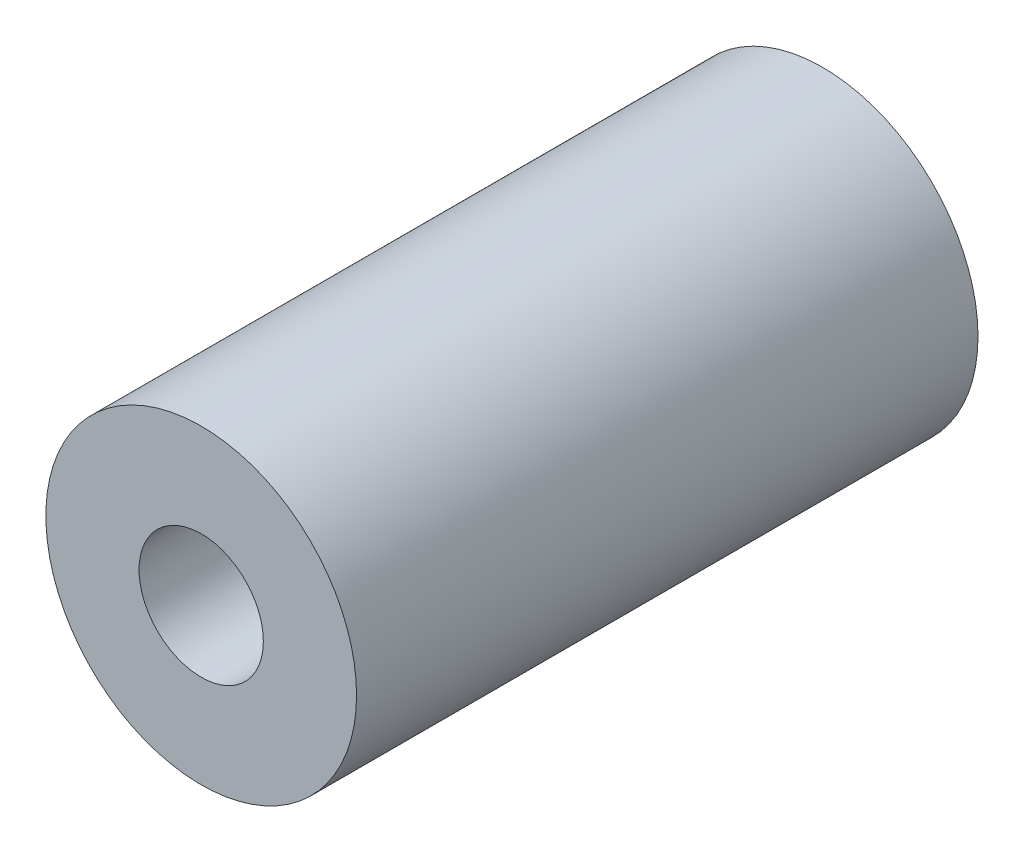
from build123d import *

# Parameters (mm, degrees)
BOSS_EXTRUDE1_DEPTH      = 19.05
BOSS_EXTRUDE1_DEPTH_BACK = 19.05
SKETCH1_R                = 9.525
SKETCH1_R_2              = 3.81


with BuildPart() as part:
    # Sketch1 → Boss-Extrude1 (new, two sides: drawn at the far end of the back side and taken through both)
    with BuildSketch(Plane.XY.offset(-BOSS_EXTRUDE1_DEPTH_BACK)):
        Circle(SKETCH1_R)
        Circle(SKETCH1_R_2, mode=Mode.SUBTRACT)
    extrude(amount=BOSS_EXTRUDE1_DEPTH + BOSS_EXTRUDE1_DEPTH_BACK)


solid = part.part
